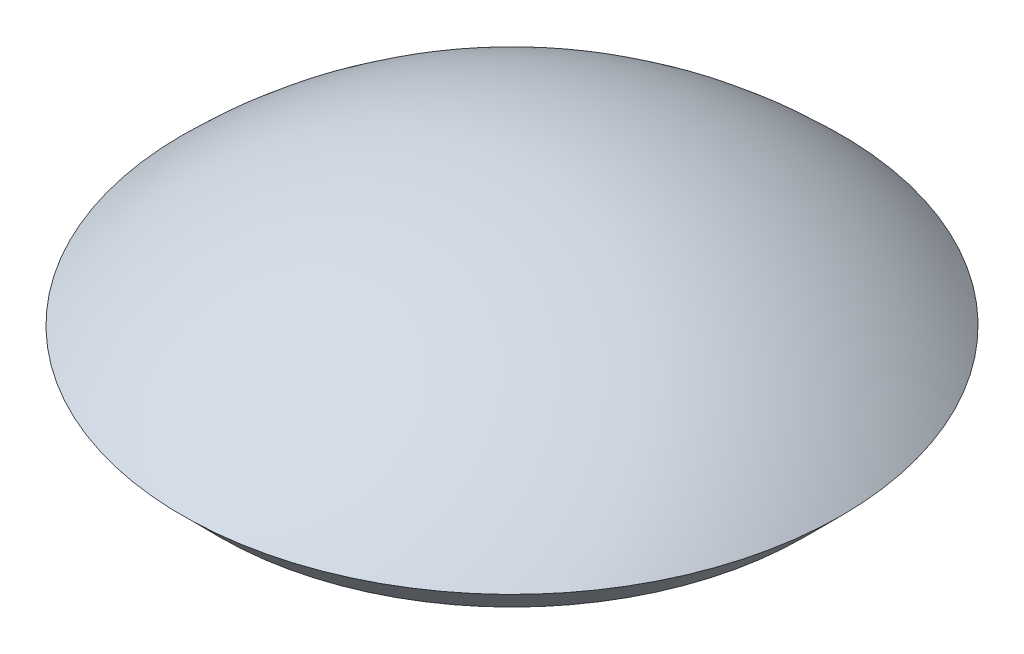
from build123d import *


with BuildPart() as part:
    # Croquis1 → Revolución1 (revolve)
    with BuildSketch(Plane.XY, mode=Mode.PRIVATE) as revoluci_n1_sk:
        with BuildLine():
            Line((19.949352426, -30.050647574), (17.67766953, -32.32233047))
            ThreePointArc((17.67766953, -32.32233047), (9.567085809, -26.903011687), (0, -25))
            Line((0, -25), (0, -21.787355239))
            ThreePointArc((0, -21.787355239), (10.796511733, -23.934914947), (19.949352426, -30.050647574))
        make_face()
    revolve(revoluci_n1_sk.sketch.rotate(Axis((0, -25, 0), (0, -1, 0)), 180), axis=Axis((0, -25, 0), (0, -1, 0)))


solid = part.part
